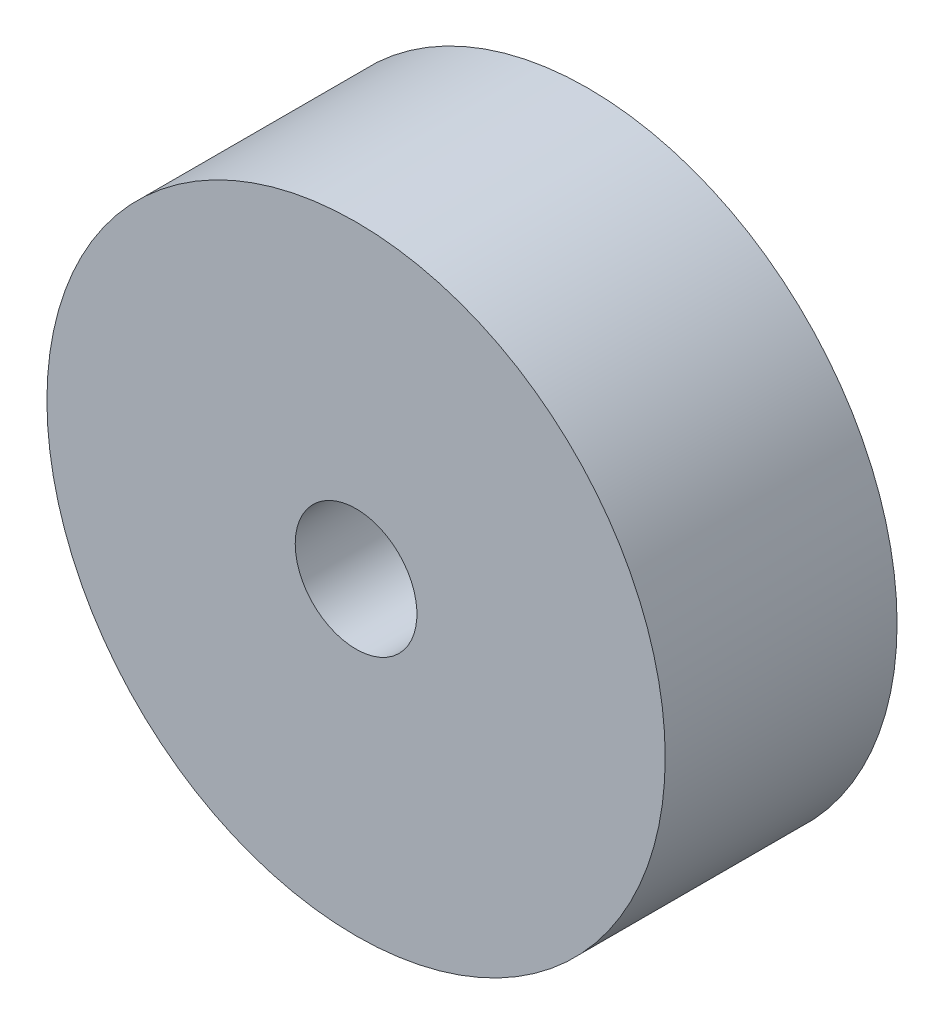
from build123d import *

# Parameters (mm, degrees)
SKETCH1_R           = 25.4
SKETCH1_R_2         = 5
BOSS_EXTRUDE1_DEPTH = 9.525


with BuildPart() as part:
    # Sketch1 → Boss-Extrude1 (new, symmetric)
    with BuildSketch(Plane.XY):
        with Locations(Location((0, 0, 0), (0, 0, 180))):
            Circle(SKETCH1_R)
        with Locations(Location((0, 0, 0), (0, 0, 180))):
            Circle(SKETCH1_R_2, mode=Mode.SUBTRACT)
    extrude(amount=BOSS_EXTRUDE1_DEPTH, both=True)


solid = part.part
